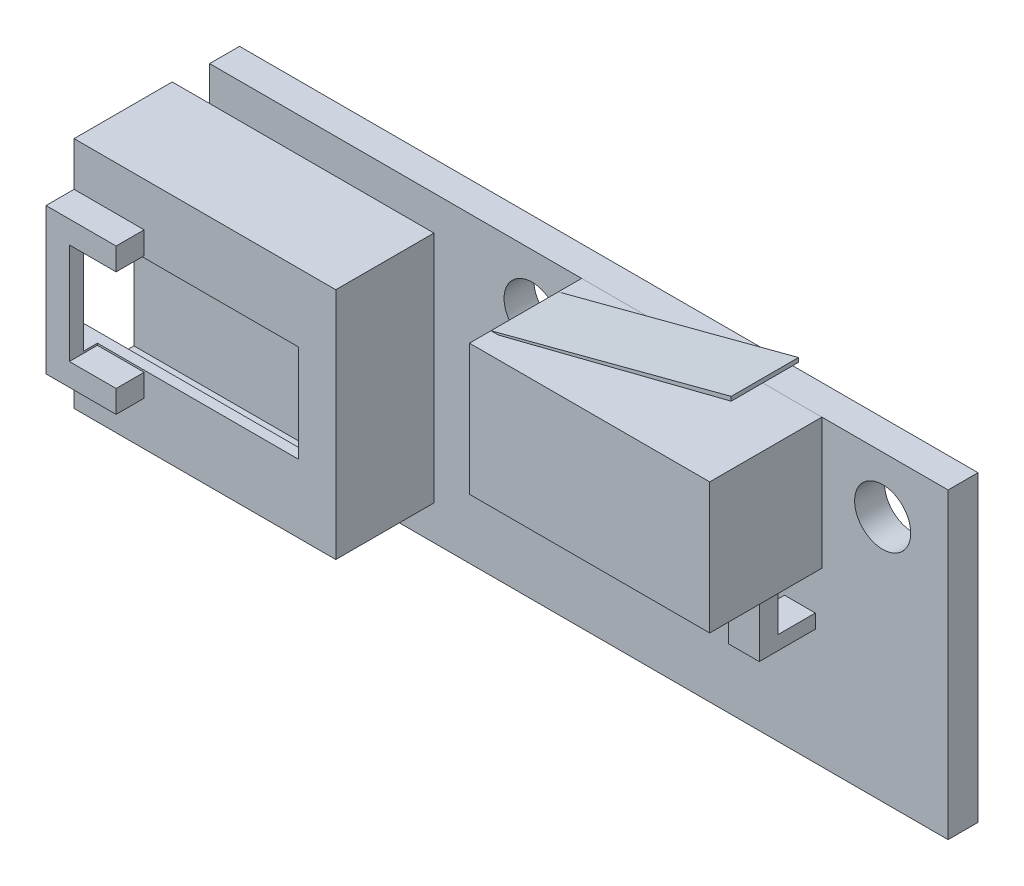
from build123d import *

# Parameters (mm, degrees)
SKETCH1_W                = 39.5
SKETCH1_H                = 16.2
BOSS_EXTRUDE1_DEPTH      = 1.6
F_3_0_3_DIAMETER_HOLE1_D = 3
SKETCH4_W                = 12.85
SKETCH4_H                = 7
BOSS_EXTRUDE2_DEPTH      = 6
SKETCH5_W                = 14
SKETCH5_H                = 12.5
BOSS_EXTRUDE3_DEPTH      = 5.25
SKETCH6_W                = 3.75
SKETCH6_H                = 7.8
BOSS_EXTRUDE4_DEPTH      = 1.5
SKETCH7_W                = 1.65
SKETCH7_H                = 3
BOSS_EXTRUDE5_DEPTH      = 3
BOSS_EXTRUDE6_START      = -1.25
BOSS_EXTRUDE6_DEPTH      = 3.6
SKETCH13_W               = 2
SKETCH13_H               = 2.25
CUT_EXTRUDE5_DEPTH       = 26.933403936
SKETCH10_W               = 1.5
SKETCH10_H               = 5.4
CUT_EXTRUDE2_DEPTH       = 2.5
SKETCH11_W               = 0.75
SKETCH11_H               = 5.2
CUT_EXTRUDE3_DEPTH       = 43.39742256
CUT_EXTRUDE4_DEPTH       = 12


with BuildPart() as part:
    # Sketch1 → Boss-Extrude1 (new body)
    with BuildSketch(Plane.XY):
        Rectangle(SKETCH1_W, SKETCH1_H)
    extrude(amount=-BOSS_EXTRUDE1_DEPTH)

    # Ø3.0 (3) Diameter Hole1 (through all)
    with Locations(Plane.XY):
        with Locations((-2.5, 5.1), (16.25, 5.1)):
            Hole(F_3_0_3_DIAMETER_HOLE1_D / 2)

    # Sketch4 → Boss-Extrude2 (add)
    with BuildSketch(Plane.XY):
        with Locations((6.575, 4.6)):
            Rectangle(SKETCH4_W, SKETCH4_H)
    extrude(amount=BOSS_EXTRUDE2_DEPTH)

    # Sketch5 → Boss-Extrude3 (add)
    with BuildSketch(Plane.XY):
        with Locations((-14.75, 0)):
            Rectangle(SKETCH5_W, SKETCH5_H)
    extrude(amount=BOSS_EXTRUDE3_DEPTH)

    # Sketch6 → Boss-Extrude4 (add)
    with BuildSketch(Plane.XY.offset(5.25)):
        with Locations((-19.875, 0)):
            Rectangle(SKETCH6_W, SKETCH6_H)
    extrude(amount=BOSS_EXTRUDE4_DEPTH)

    # Sketch7 → Boss-Extrude5 (add)
    with BuildSketch(Plane.XY):
        with Locations((11.825, -0.4)):
            Rectangle(SKETCH7_W, SKETCH7_H)
        with Locations((6.575, -0.4)):
            Rectangle(SKETCH7_W, SKETCH7_H)
        with Locations((1.325, -0.4)):
            Rectangle(SKETCH7_W, SKETCH7_H)
    extrude(amount=BOSS_EXTRUDE5_DEPTH)

    # Sketch8 → Boss-Extrude6 (add)
    with BuildSketch(Plane(origin=(0, 0, 0), x_dir=(-1, 0, 0), z_dir=(0, 0, -1)).offset(BOSS_EXTRUDE6_START)):
        Polygon((-13, 11.261122396), (-0.555210526, 8.1), (-0.15, 8.1), (-13, 11.485488222), align=None)
    extrude(amount=-BOSS_EXTRUDE6_DEPTH)

    # Sketch13 → Cut-Extrude5 (cut, through all)
    with BuildSketch(Plane.ZY.offset(-0.5)):
        with Locations((1, -0.025)):
            Rectangle(SKETCH13_W, SKETCH13_H)
    extrude(amount=-CUT_EXTRUDE5_DEPTH, mode=Mode.SUBTRACT)

    # Sketch10 → Cut-Extrude2 (cut)
    with BuildSketch(Plane(origin=(-18, 0, 0), x_dir=(0, 0, -1), z_dir=(1, 0, 0))):
        with Locations((-6, 0)):
            Rectangle(SKETCH10_W, SKETCH10_H)
    extrude(amount=-CUT_EXTRUDE2_DEPTH, mode=Mode.SUBTRACT)

    # Sketch11 → Cut-Extrude3 (cut, through all)
    with BuildSketch(Plane(origin=(-20.5, 0, 0), x_dir=(0, 0, -1), z_dir=(1, 0, 0))):
        with Locations((-5.625, 0)):
            Rectangle(SKETCH11_W, SKETCH11_H)
    extrude(amount=-CUT_EXTRUDE3_DEPTH, mode=Mode.SUBTRACT)

    # Sketch12 → Cut-Extrude4 (cut)
    with BuildSketch(Plane(origin=(-21.75, 0, 0), x_dir=(0, 0, -1), z_dir=(1, 0, 0))):
        Polygon((-6, -2.6), (-4.7, -2.6), (-4.7, -4.95), (-2.05, -4.95), (-2.05, 4.95), (-4.7, 4.95), (-4.7, 2.6), (-6, 2.6), align=None)
    extrude(amount=CUT_EXTRUDE4_DEPTH, mode=Mode.SUBTRACT)


solid = part.part
